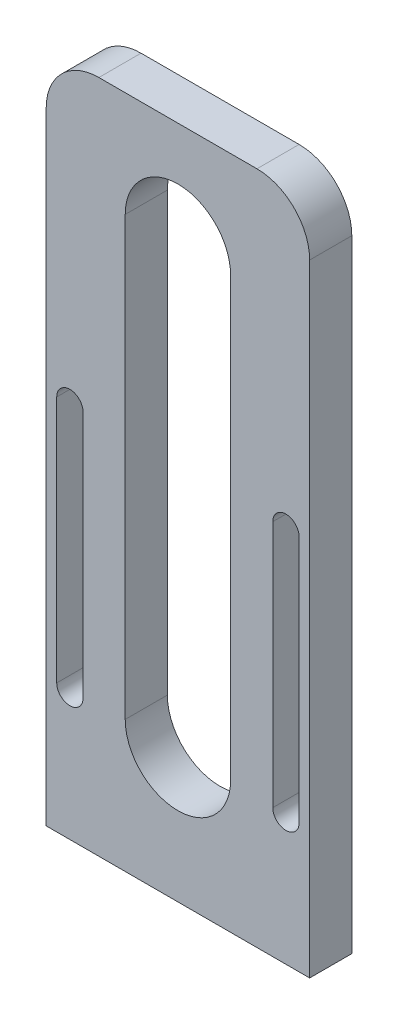
from build123d import *

# Parameters (mm, degrees)
DODANIE_WYCI_GNI_CIE1_DEPTH = 4


with BuildPart() as part:
    # Szkic1 → Dodanie-wyciągnięcie1 (new body)
    with BuildSketch(Plane.XY):
        with BuildLine():
            Line((-12.5, 0), (12.5, 0))
            Line((12.5, 0), (12.5, 59))
            ThreePointArc((12.5, 59), (11.035533906, 62.535533906), (7.5, 64))
            Line((7.5, 64), (-7.5, 64))
            ThreePointArc((-7.5, 64), (-11.035533906, 62.535533906), (-12.5, 59))
            Line((-12.5, 59), (-12.5, 0))
        make_face()
        with BuildLine():
            Line((5, 54), (5, 12.5))
            ThreePointArc((5, 12.5), (0, 7.5), (-5, 12.5))
            Line((-5, 12.5), (-5, 54))
            ThreePointArc((-5, 54), (0, 59), (5, 54))
        make_face(mode=Mode.SUBTRACT)
        with BuildLine():
            Line((-9, 35.75), (-9, 12.25))
            ThreePointArc((-9, 12.25), (-10.25, 11), (-11.5, 12.25))
            Line((-11.5, 12.25), (-11.5, 35.75))
            ThreePointArc((-11.5, 35.75), (-10.25, 37), (-9, 35.75))
        make_face(mode=Mode.SUBTRACT)
        with BuildLine():
            Line((9, 35.75), (9, 12.25))
            ThreePointArc((9, 12.25), (10.25, 11), (11.5, 12.25))
            Line((11.5, 12.25), (11.5, 35.75))
            ThreePointArc((11.5, 35.75), (10.25, 37), (9, 35.75))
        make_face(mode=Mode.SUBTRACT)
    extrude(amount=DODANIE_WYCI_GNI_CIE1_DEPTH)


solid = part.part
